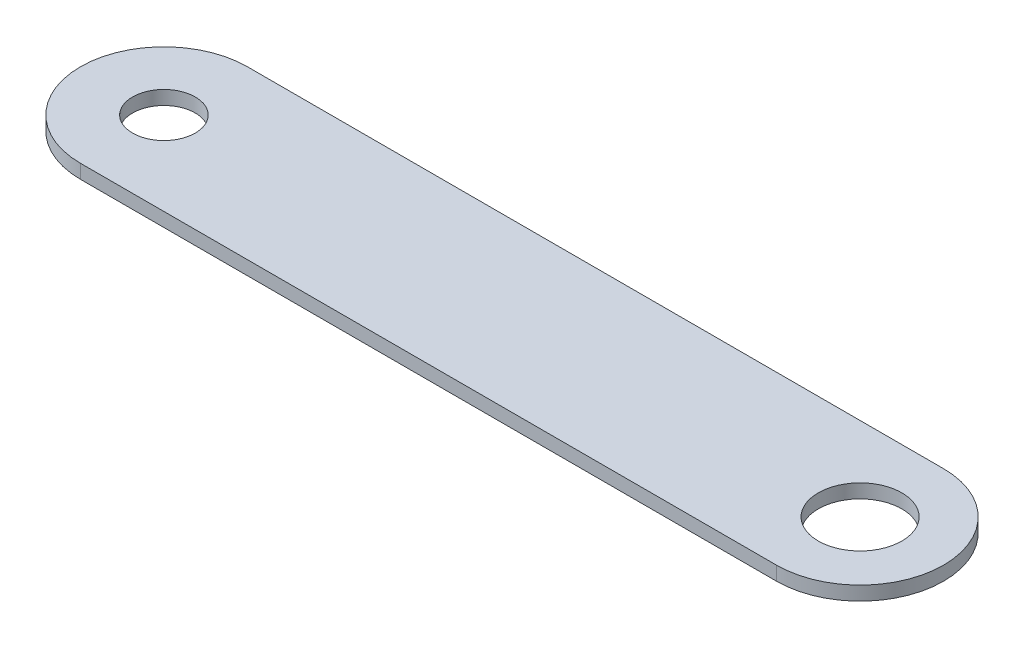
from build123d import *

# Parameters (mm, degrees)
SKETCH1_R           = 2.25
SKETCH1_R_2         = 3
BOSS_EXTRUDE1_DEPTH = 1


with BuildPart() as part:
    # Sketch1 → Boss-Extrude1 (new body)
    with BuildSketch(Plane(origin=(0, 0, 0), x_dir=(1, 0, 0), z_dir=(0, 1, 0))):
        with BuildLine():
            Line((0, 6), (50, 6))
            ThreePointArc((50, 6), (56, 0), (50, -6))
            Line((50, -6), (0, -6))
            ThreePointArc((0, -6), (-6, 0), (0, 6))
        make_face()
        with Locations(Location((0, 0, 0), (0, 0, 270))):
            Circle(SKETCH1_R, mode=Mode.SUBTRACT)
        with Locations(Location((50, 0, 0), (0, 0, 270))):
            Circle(SKETCH1_R_2, mode=Mode.SUBTRACT)
    extrude(amount=BOSS_EXTRUDE1_DEPTH)


solid = part.part
